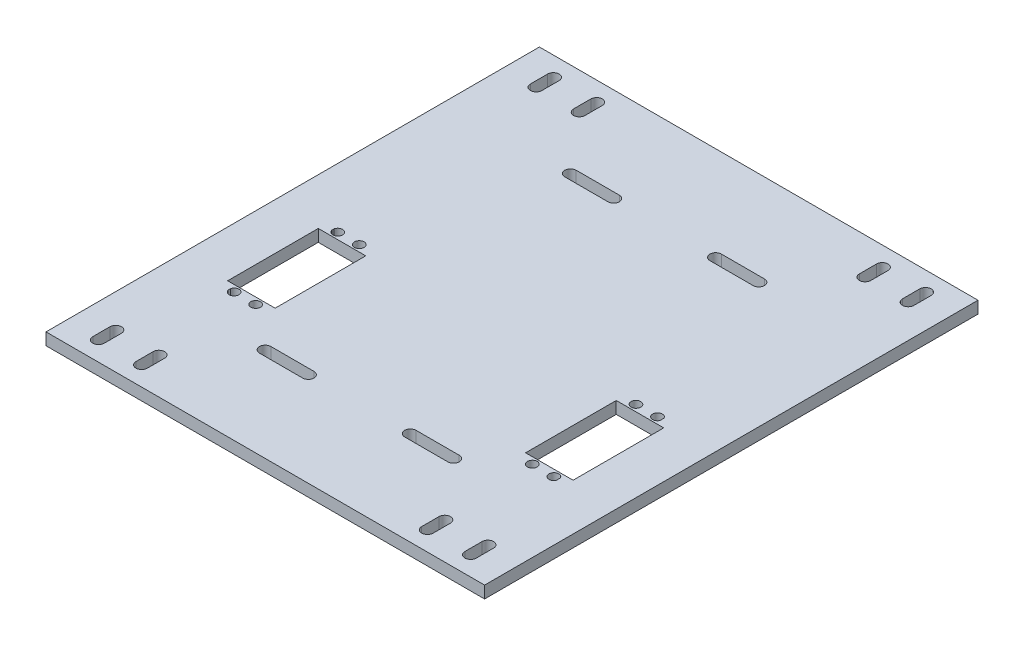
from build123d import *

# Parameters (mm, degrees)
SKETCH1_W                                = 152.4
SKETCH1_H                                = 228.6
BOSS_EXTRUDE1_DEPTH                      = 5.588
SKETCH2_R                                = 2.25
SKETCH2_W                                = 22
SKETCH2_H                                = 42
CUT_EXTRUDE1_DEPTH                       = 138.48511099
SKETCH6_R                                = 2.65
CUT_EXTRUDE2_DEPTH                       = 430.910746044
CUT_EXTRUDE3_DEPTH                       = 138.48511099
MIRROR1_AT_THE_SECOND_PLANE_COPY_1_DEPTH = 138.48511099
SKETCH8_R                                = 2.65
CUT_EXTRUDE4_DEPTH                       = 430.910746044
CUT_EXTRUDE5_DEPTH                       = 138.48511099
MIRROR2_AT_THE_SECOND_PLANE_COPY_1_DEPTH = 138.48511099
SKETCH10_W                               = 228.6
SKETCH10_H                               = 5.588
BOSS_EXTRUDE2_DEPTH                      = 25.4
SKETCH11_W                               = 22
SKETCH11_H                               = 42
CUT_EXTRUDE6_DEPTH                       = 154.030309887
CUT_EXTRUDE7_DEPTH                       = 154.030309887
MIRROR5_AT_THE_SECOND_PLANE_COPY_1_DEPTH = 154.030309887


with BuildPart() as part:
    # Sketch1 → Boss-Extrude1 (new body)
    with BuildSketch(Plane(origin=(0, 0, 0), x_dir=(1, 0, 0), z_dir=(0, 1, 0))):
        Rectangle(SKETCH1_W, SKETCH1_H)
    extrude(amount=BOSS_EXTRUDE1_DEPTH)

    # Sketch2 → Cut-Extrude1 (cut, through all)
    with BuildSketch(Plane(origin=(0, 5.588, 0), x_dir=(1, 0, 0), z_dir=(0, 1, 0))):
        with Locations(Location((64.145199836, -6.727348554, 0), (0, 0, 270))):
            Circle(SKETCH2_R)
        with Locations((74.145199836, -6.727348554)):
            Circle(SKETCH2_R)
        with Locations(Location((64.145199836, -54.727348554, 0), (0, 0, 270))):
            Circle(SKETCH2_R)
        with Locations((74.145199836, -54.727348554)):
            Circle(SKETCH2_R)
        with Locations((-74.023936008, -54.727348554)):
            Circle(SKETCH2_R)
        with Locations(Location((-64.023936008, -54.727348554, 0), (0, 0, 90))):
            Circle(SKETCH2_R)
        with Locations((-74.023936008, -6.727348554)):
            Circle(SKETCH2_R)
        with Locations(Location((-64.023936008, -6.727348554, 0), (0, 0, 90))):
            Circle(SKETCH2_R)
        with Locations((69.145199836, -30.727348554)):
            Rectangle(SKETCH2_W, SKETCH2_H)
        with Locations((-69.023936008, -30.727348554)):
            Rectangle(SKETCH2_W, SKETCH2_H)
    extrude(amount=-CUT_EXTRUDE1_DEPTH, mode=Mode.SUBTRACT)

    # Sketch6 → Cut-Extrude2 (cut, through all)
    with BuildSketch(Plane(origin=(-338.200209725, 5.588, 0), x_dir=(1, 0, 0), z_dir=(0, 1, 0))):
        with Locations(Location((404.400209725, 104.3, 0), (0, 0, 270))):
            Circle(SKETCH6_R)
    extrude(amount=-CUT_EXTRUDE2_DEPTH, mode=Mode.SUBTRACT)

    # Sketch7 → Cut-Extrude3 (cut, through all)
    with BuildSketch(Plane(origin=(0, 5.588, 0), x_dir=(1, 0, 0), z_dir=(0, 1, 0))):
        with BuildLine():
            Line((68.85, 105.377738503), (68.85, 97.377738503))
            ThreePointArc((68.85, 97.377738503), (66.2, 94.727738503), (63.55, 97.377738503))
            Line((63.55, 97.377738503), (63.55, 105.377738503))
            ThreePointArc((63.55, 105.377738503), (66.2, 108.027738503), (68.85, 105.377738503))
        make_face()
    cut_extrude3 = extrude(amount=-CUT_EXTRUDE3_DEPTH, mode=Mode.SUBTRACT)

    # Mirror1: Cut-Extrude3 across plane
    add(cut_extrude3.mirror(Plane.XY), mode=Mode.SUBTRACT)

    # Mirror1 at the second plane: Cut-Extrude3 across plane
    add(cut_extrude3.mirror(Plane(origin=(0, 0, 0), x_dir=(0, 0, 1), z_dir=(1, 0, 0))), mode=Mode.SUBTRACT)

    # Mirror1 at the second plane copy 1 sketc → Mirror1 at the second plane copy 1 (cut, through all)
    with BuildSketch(Plane(origin=(0, 5.588, 0), x_dir=(-1, 0, 0), z_dir=(0, 1, 0))):
        with BuildLine():
            Line((68.85, 105.377738503), (68.85, 97.377738503))
            ThreePointArc((68.85, 97.377738503), (66.2, 94.727738503), (63.55, 97.377738503))
            Line((63.55, 97.377738503), (63.55, 105.377738503))
            ThreePointArc((63.55, 105.377738503), (66.2, 108.027738503), (68.85, 105.377738503))
        make_face()
    extrude(amount=-MIRROR1_AT_THE_SECOND_PLANE_COPY_1_DEPTH, mode=Mode.SUBTRACT)

    # Sketch8 → Cut-Extrude4 (cut, through all)
    with BuildSketch(Plane(origin=(-338.200209725, 5.588, 0), x_dir=(1, 0, 0), z_dir=(0, 1, 0))):
        with Locations(Location((381.82832329, 70.726177663, 0), (0, 0, 270))):
            Circle(SKETCH8_R)
    extrude(amount=-CUT_EXTRUDE4_DEPTH, mode=Mode.SUBTRACT)

    # Sketch9 → Cut-Extrude5 (cut, through all)
    with BuildSketch(Plane(origin=(0, 5.588, 0), x_dir=(1, 0, 0), z_dir=(0, 1, 0))):
        with BuildLine():
            Line((43.628113565, 68.076177663), (23.628113565, 68.076177663))
            ThreePointArc((23.628113565, 68.076177663), (20.978113565, 70.726177663), (23.628113565, 73.376177663))
            Line((23.628113565, 73.376177663), (43.628113565, 73.376177663))
            ThreePointArc((43.628113565, 73.376177663), (46.278113565, 70.726177663), (43.628113565, 68.076177663))
        make_face()
    cut_extrude5 = extrude(amount=-CUT_EXTRUDE5_DEPTH, mode=Mode.SUBTRACT)

    # Mirror2: Cut-Extrude5 across plane
    add(cut_extrude5.mirror(Plane.XY), mode=Mode.SUBTRACT)

    # Mirror2 at the second plane: Cut-Extrude5 across plane
    add(cut_extrude5.mirror(Plane(origin=(0, 0, 0), x_dir=(0, 0, 1), z_dir=(1, 0, 0))), mode=Mode.SUBTRACT)

    # Mirror2 at the second plane copy 1 sketc → Mirror2 at the second plane copy 1 (cut, through all)
    with BuildSketch(Plane(origin=(0, 5.588, 0), x_dir=(-1, 0, 0), z_dir=(0, 1, 0))):
        with BuildLine():
            Line((43.628113565, 68.076177663), (23.628113565, 68.076177663))
            ThreePointArc((23.628113565, 68.076177663), (20.978113565, 70.726177663), (23.628113565, 73.376177663))
            Line((23.628113565, 73.376177663), (43.628113565, 73.376177663))
            ThreePointArc((43.628113565, 73.376177663), (46.278113565, 70.726177663), (43.628113565, 68.076177663))
        make_face()
    extrude(amount=-MIRROR2_AT_THE_SECOND_PLANE_COPY_1_DEPTH, mode=Mode.SUBTRACT)

    # Sketch10 → Boss-Extrude2 (add)
    with BuildSketch(Plane.ZY.offset(76.2)):
        with Locations((0, 2.794)):
            Rectangle(SKETCH10_W, SKETCH10_H)
    boss_extrude2 = extrude(amount=BOSS_EXTRUDE2_DEPTH)

    # Sketch11 → Cut-Extrude6 (cut, through all)
    with BuildSketch(Plane(origin=(0, 5.588, 0), x_dir=(1, 0, 0), z_dir=(0, 1, 0))):
        with Locations((-69.023936008, -30.727348554)):
            Rectangle(SKETCH11_W, SKETCH11_H)
    cut_extrude6 = extrude(amount=-CUT_EXTRUDE6_DEPTH, mode=Mode.SUBTRACT)

    # Mirror4: Boss-Extrude2, Cut-Extrude6 across plane
    add(boss_extrude2.mirror(Plane(origin=(0, 0, 0), x_dir=(0, 0, 1), z_dir=(1, 0, 0))))
    add(cut_extrude6.mirror(Plane(origin=(0, 0, 0), x_dir=(0, 0, 1), z_dir=(1, 0, 0))), mode=Mode.SUBTRACT)

    # Sketch12 → Cut-Extrude7 (cut, through all)
    with BuildSketch(Plane(origin=(0, 5.588, 0), x_dir=(1, 0, 0), z_dir=(0, 1, 0))):
        with BuildLine():
            Line((-83.55, -97.377738503), (-83.55, -105.377738503))
            ThreePointArc((-83.55, -105.377738503), (-86.2, -108.027738503), (-88.85, -105.377738503))
            Line((-88.85, -105.377738503), (-88.85, -97.377738503))
            ThreePointArc((-88.85, -97.377738503), (-86.2, -94.727738503), (-83.55, -97.377738503))
        make_face()
    cut_extrude7 = extrude(amount=-CUT_EXTRUDE7_DEPTH, mode=Mode.SUBTRACT)

    # Mirror5: Cut-Extrude7 across plane
    add(cut_extrude7.mirror(Plane(origin=(0, 0, 0), x_dir=(0, 0, 1), z_dir=(1, 0, 0))), mode=Mode.SUBTRACT)

    # Mirror5 at the second plane: Cut-Extrude7 across plane
    add(cut_extrude7.mirror(Plane.XY), mode=Mode.SUBTRACT)

    # Mirror5 at the second plane copy 1 sketc → Mirror5 at the second plane copy 1 (cut, through all)
    with BuildSketch(Plane(origin=(0, 5.588, 0), x_dir=(-1, 0, 0), z_dir=(0, 1, 0))):
        with BuildLine():
            Line((-83.55, -97.377738503), (-83.55, -105.377738503))
            ThreePointArc((-83.55, -105.377738503), (-86.2, -108.027738503), (-88.85, -105.377738503))
            Line((-88.85, -105.377738503), (-88.85, -97.377738503))
            ThreePointArc((-88.85, -97.377738503), (-86.2, -94.727738503), (-83.55, -97.377738503))
        make_face()
    extrude(amount=-MIRROR5_AT_THE_SECOND_PLANE_COPY_1_DEPTH, mode=Mode.SUBTRACT)


solid = part.part
